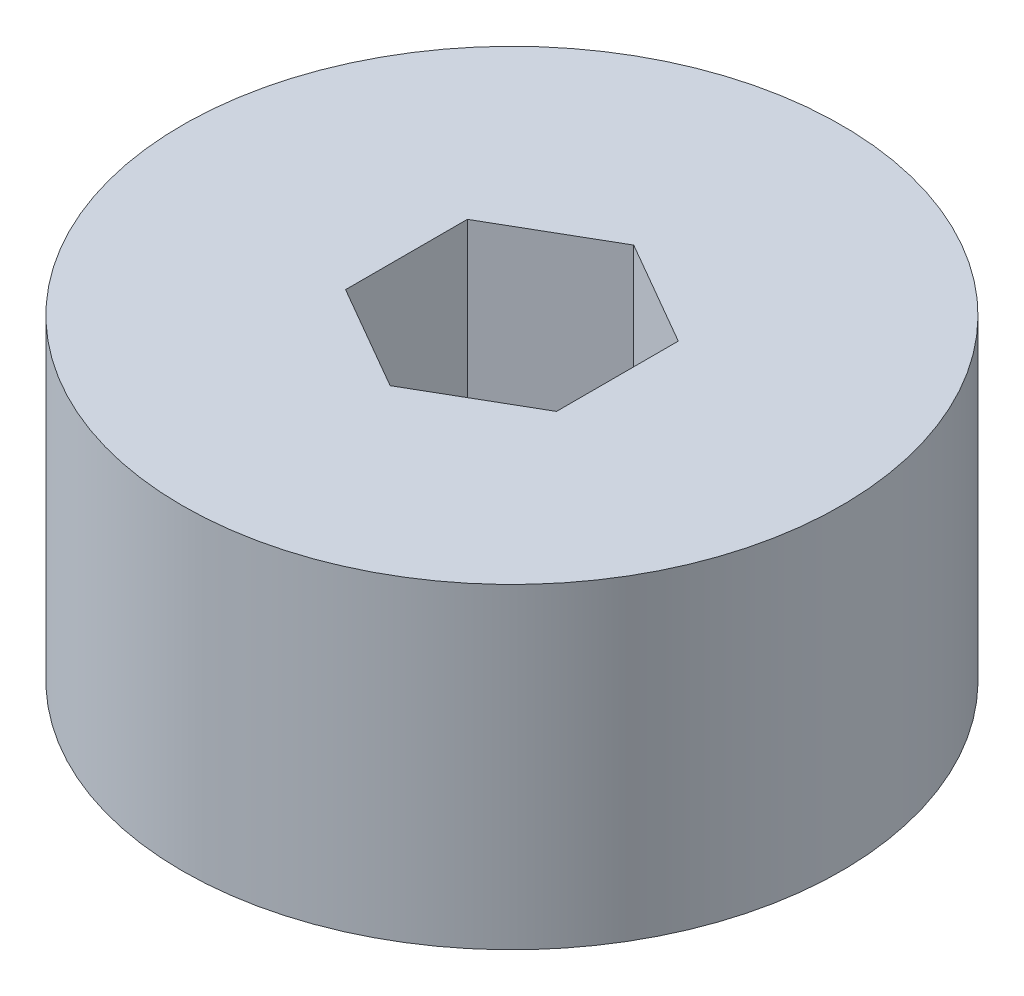
from build123d import *

# Parameters (mm, degrees)
SKETCH1_R           = 12.5
BOSS_EXTRUDE1_DEPTH = 12
CUT_EXTRUDE1_DEPTH  = 8.2


with BuildPart() as part:
    # Sketch1 → Boss-Extrude1 (new body)
    with BuildSketch(Plane(origin=(0, 0, 0), x_dir=(1, 0, 0), z_dir=(0, 1, 0))):
        with Locations(Location((0, 0, 0), (0, 0, 270))):
            Circle(SKETCH1_R)
    extrude(amount=BOSS_EXTRUDE1_DEPTH)

    # Sketch2 → Cut-Extrude1 (cut)
    with BuildSketch(Plane(origin=(0, 12, 0), x_dir=(1, 0, 0), z_dir=(0, 1, 0))):
        Polygon((0, -4.618802154), (4, -2.309401077), (4, 2.309401077), (0, 4.618802154), (-4, 2.309401077), (-4, -2.309401077), align=None)
    extrude(amount=-CUT_EXTRUDE1_DEPTH, mode=Mode.SUBTRACT)


solid = part.part
